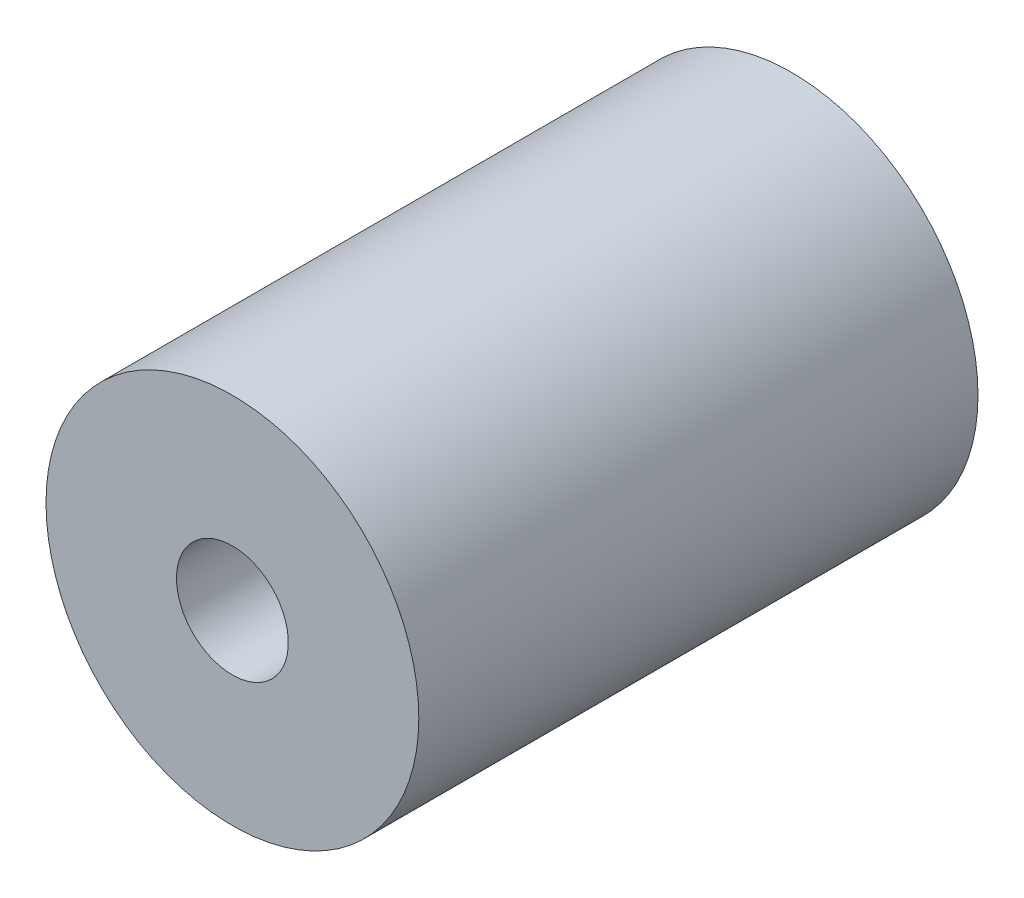
from build123d import *

# Parameters (mm, degrees)
SKIZZE1_R                          = 5
AUFSATZ_LINEAR_AUSTRAGEN1_DEPTH    = 15
F_1_5_1_5_DURCHMESSER_BOHRUNG1_D   = 1.5
F_3_0_3_DURCHMESSER_BOHRUNG1_D     = 3
F_3_0_3_DURCHMESSER_BOHRUNG1_DEPTH = 15
F_3_0_3_DURCHMESSER_BOHRUNG1_TIP   = 0.901290929


with BuildPart() as part:
    # Skizze1 → Aufsatz-Linear austragen1 (new body)
    with BuildSketch(Plane.XY):
        with Locations((10.949316523, -75.497467638)):
            Circle(SKIZZE1_R)
    extrude(amount=AUFSATZ_LINEAR_AUSTRAGEN1_DEPTH)

    # Ø1.5 (1.5) Durchmesser Bohrung1 (through all)
    with Locations(Plane.XY.offset(15)):
        with Locations((10.949316523, -75.497467638)):
            Hole(F_1_5_1_5_DURCHMESSER_BOHRUNG1_D / 2)

    # Ø3.0 (3) Durchmesser Bohrung1
    with Locations(Plane(origin=(0, 0, 0), x_dir=(-1, 0, 0), z_dir=(0, 0, -1))):
        with Locations((-10.949316523, -75.497467638)):
            Hole(F_3_0_3_DURCHMESSER_BOHRUNG1_D / 2, depth=F_3_0_3_DURCHMESSER_BOHRUNG1_DEPTH)
            with Locations((0, 0, -(F_3_0_3_DURCHMESSER_BOHRUNG1_DEPTH + F_3_0_3_DURCHMESSER_BOHRUNG1_TIP / 2))):  # 118° drill point
                Cone(0, F_3_0_3_DURCHMESSER_BOHRUNG1_D / 2, F_3_0_3_DURCHMESSER_BOHRUNG1_TIP, mode=Mode.SUBTRACT)


solid = part.part
